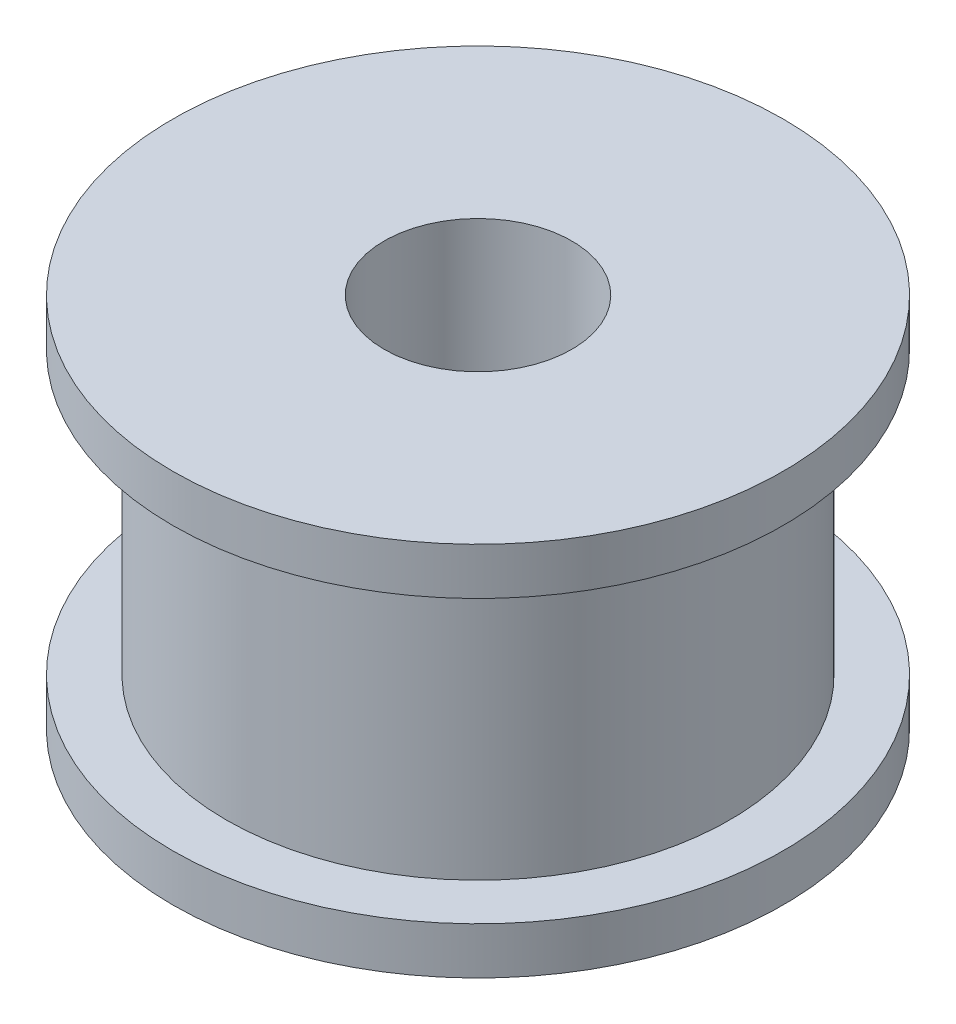
from build123d import *

# Parameters (mm, degrees)
SKETCH1_R           = 10.725
BOSS_EXTRUDE1_DEPTH = 6
BOSS_EXTRUDE2_START = 6
SKETCH2_R           = 13
BOSS_EXTRUDE2_DEPTH = 2
BOSS_EXTRUDE3_START = -8
SKETCH2_2_R         = 13
BOSS_EXTRUDE3_DEPTH = 2
CUT_EXTRUDE1_REACH  = 26.372
SKETCH3_R           = 4


with BuildPart() as part:
    # Sketch1 → Boss-Extrude1 (new, symmetric)
    with BuildSketch(Plane(origin=(0, 0, 0), x_dir=(1, 0, 0), z_dir=(0, 1, 0))):
        with Locations(Location((0, 0, 0), (0, 0, 270))):
            Circle(SKETCH1_R)
    extrude(amount=BOSS_EXTRUDE1_DEPTH, both=True)

    # Sketch2 → Boss-Extrude2 (add)
    with BuildSketch(Plane(origin=(0, 0, 0), x_dir=(1, 0, 0), z_dir=(0, 1, 0)).offset(BOSS_EXTRUDE2_START)):
        with Locations(Location((0, 0, 0), (0, 0, 270))):
            Circle(SKETCH2_R)
    extrude(amount=BOSS_EXTRUDE2_DEPTH)

    # Sketch2<2> → Boss-Extrude3 (add)
    with BuildSketch(Plane(origin=(0, 0, 0), x_dir=(1, 0, 0), z_dir=(0, 1, 0)).offset(BOSS_EXTRUDE3_START)):
        with Locations(Location((0, 0, 0), (0, 0, 270))):
            Circle(SKETCH2_2_R)
    extrude(amount=BOSS_EXTRUDE3_DEPTH)

    # Sketch3 → Cut-Extrude1 (cut, up to next)
    with BuildSketch(Plane(origin=(0, 8, 0), x_dir=(1, 0, 0), z_dir=(0, 1, 0)), mode=Mode.PRIVATE) as cut_extrude1_sk1:
        with Locations(Location((0, 0, 0), (0, 0, 270))):
            Circle(SKETCH3_R)
    cut_extrude1_tool1 = extrude(cut_extrude1_sk1.sketch, amount=-CUT_EXTRUDE1_REACH, mode=Mode.PRIVATE) & part.part
    add(cut_extrude1_tool1.solids().sort_by_distance((0, 8, 0))[0], mode=Mode.SUBTRACT)


solid = part.part
